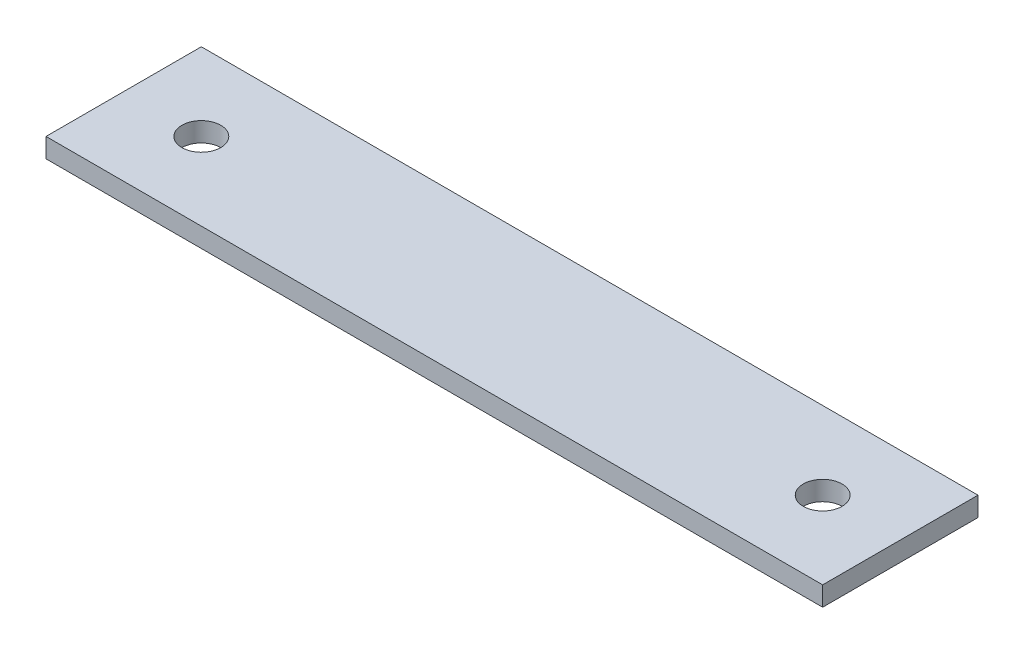
from build123d import *

# Parameters (mm, degrees)
SKETCH1_W           = 127
SKETCH1_H           = 25.4
BOSS_EXTRUDE1_DEPTH = 3.175
SKETCH2_R           = 3.175
CUT_EXTRUDE1_DEPTH  = 3.175


with BuildPart() as part:
    # Sketch1 → Boss-Extrude1 (new body)
    with BuildSketch(Plane(origin=(0, 0, 0), x_dir=(1, 0, 0), z_dir=(0, 1, 0))):
        with Locations((63.5, 12.7)):
            Rectangle(SKETCH1_W, SKETCH1_H)
    extrude(amount=BOSS_EXTRUDE1_DEPTH)

    # Sketch2 → Cut-Extrude1 (cut)
    with BuildSketch(Plane(origin=(0, 3.175, 0), x_dir=(1, 0, 0), z_dir=(0, 1, 0))):
        with Locations(Location((12.7, 12.7, 0), (0, 0, 270))):
            Circle(SKETCH2_R)
        with Locations(Location((114.3, 12.7, 0), (0, 0, 270))):
            Circle(SKETCH2_R)
    extrude(amount=-CUT_EXTRUDE1_DEPTH, mode=Mode.SUBTRACT)


solid = part.part
